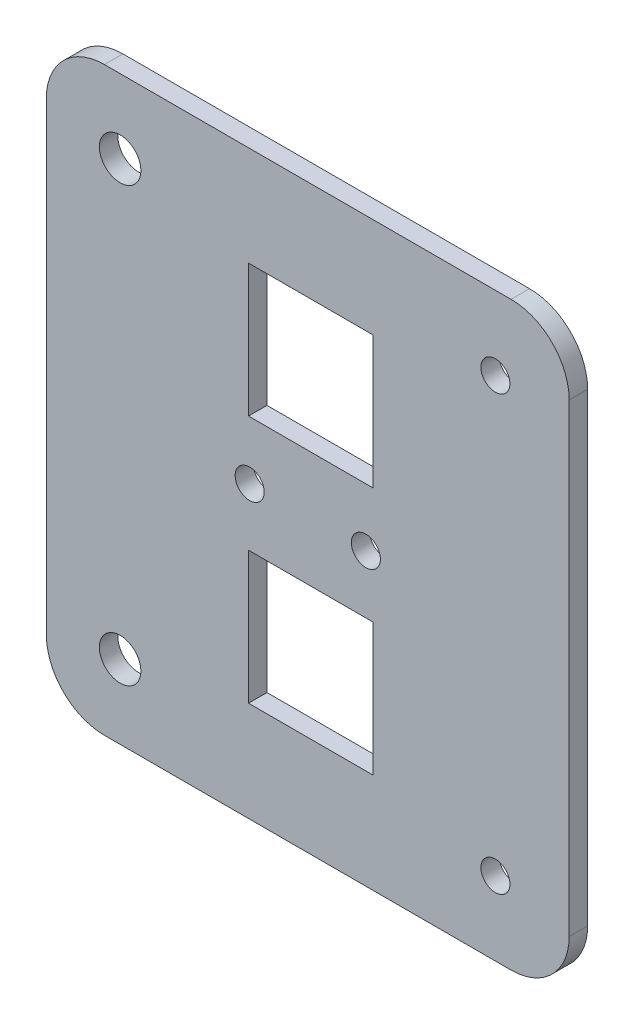
from build123d import *

# Parameters (mm, degrees)
BOSS_EXTRUDE1_START = 19.16
SKETCH1_W           = 90
SKETCH1_H           = 100
SKETCH1_R           = 2.5
SKETCH1_R_2         = 3.57
BOSS_EXTRUDE1_DEPTH = 3.18
FILLET1_R           = 10
SKETCH2_R           = 2.5
CUT_EXTRUDE1_DEPTH  = 10
SKETCH3_W           = 21.4
SKETCH3_H           = 22.810510703
CUT_EXTRUDE2_DEPTH  = 72.134467033


with BuildPart() as part:
    # Sketch1 → Boss-Extrude1 (new body)
    with BuildSketch(Plane.XY.offset(BOSS_EXTRUDE1_START)):
        with Locations((0, -5)):
            Rectangle(SKETCH1_W, SKETCH1_H)
        with Locations((32.3, -42.3)):
            Circle(SKETCH1_R, mode=Mode.SUBTRACT)
        with Locations((-32.3, -42.3)):
            Circle(SKETCH1_R_2, mode=Mode.SUBTRACT)
        with Locations((-32.3, 32.3)):
            Circle(SKETCH1_R_2, mode=Mode.SUBTRACT)
        with Locations((32.3, 32.3)):
            Circle(SKETCH1_R, mode=Mode.SUBTRACT)
    extrude(amount=-BOSS_EXTRUDE1_DEPTH)

    # Fillet1
    fillet1_edges = [part.edges().sort_by_distance(p)[0] for p in [
        (-45, 45, 17.57),
        (45, 45, 17.57),
        (45, -55, 17.57),
        (-45, -55, 17.57),
    ]]
    fillet(fillet1_edges, radius=FILLET1_R)

    # Sketch2 → Cut-Extrude1 (cut)
    with BuildSketch(Plane.XY.offset(19.16)):
        with Locations((10, -5)):
            Circle(SKETCH2_R)
        with Locations((-10, -5)):
            Circle(SKETCH2_R)
    extrude(amount=-CUT_EXTRUDE1_DEPTH, mode=Mode.SUBTRACT)

    # Sketch3 → Cut-Extrude2 (cut, through all)
    with BuildSketch(Plane(origin=(0, 0, 15.98), x_dir=(-1, 0, 0), z_dir=(0, 0, -1))):
        with Locations((-0.5, 16.405255352)):
            Rectangle(SKETCH3_W, SKETCH3_H)
        with Locations((-0.5, -26.405255352)):
            Rectangle(SKETCH3_W, SKETCH3_H)
    extrude(amount=-CUT_EXTRUDE2_DEPTH, mode=Mode.SUBTRACT)


solid = part.part
